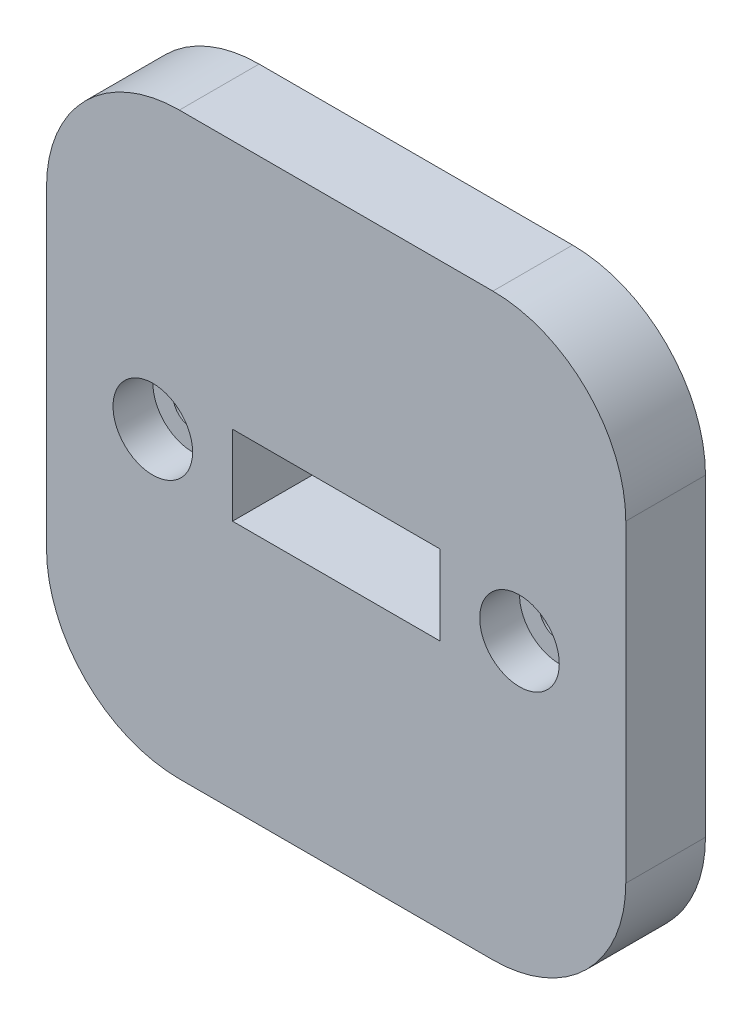
from build123d import *

# Parameters (mm, degrees)
ESQUISSE1_W             = 43.6
ESQUISSE1_H             = 43.6
BOSS_EXTRU_1_DEPTH      = 6
CONG_1_R                = 10
ESQUISSE2_R             = 1.5
ESQUISSE2_W             = 15.6
ESQUISSE2_H             = 6
ENL_V_MAT_EXTRU_1_DEPTH = 6
ESQUISSE3_R             = 2.995
ENL_V_MAT_EXTRU_2_DEPTH = 3


with BuildPart() as part:
    # Esquisse1 → Boss.-Extru.1 (new body)
    with BuildSketch(Plane.XY):
        with Locations((21.8, 21.8)):
            Rectangle(ESQUISSE1_W, ESQUISSE1_H)
    extrude(amount=BOSS_EXTRU_1_DEPTH)

    # Congé1
    cong_1_edges = [part.edges().sort_by_distance(p)[0] for p in [
        (0, 43.6, 3),
        (43.6, 43.6, 3),
        (43.6, 0, 3),
        (0, 0, 3),
    ]]
    fillet(cong_1_edges, radius=CONG_1_R)

    # Esquisse2 → Enlèv. mat.-Extru.1 (cut)
    with BuildSketch(Plane.XY.offset(6)):
        with Locations((8, 21.8)):
            Circle(ESQUISSE2_R)
        with Locations((35.6, 21.8)):
            Circle(ESQUISSE2_R)
        with Locations((21.8, 21.8)):
            Rectangle(ESQUISSE2_W, ESQUISSE2_H)
    extrude(amount=-ENL_V_MAT_EXTRU_1_DEPTH, mode=Mode.SUBTRACT)

    # Esquisse3 → Enlèv. mat.-Extru.2 (cut)
    with BuildSketch(Plane.XY.offset(6)):
        with Locations((8, 21.8)):
            Circle(ESQUISSE3_R)
        with Locations((35.6, 21.8)):
            Circle(ESQUISSE3_R)
    extrude(amount=-ENL_V_MAT_EXTRU_2_DEPTH, mode=Mode.SUBTRACT)


solid = part.part
